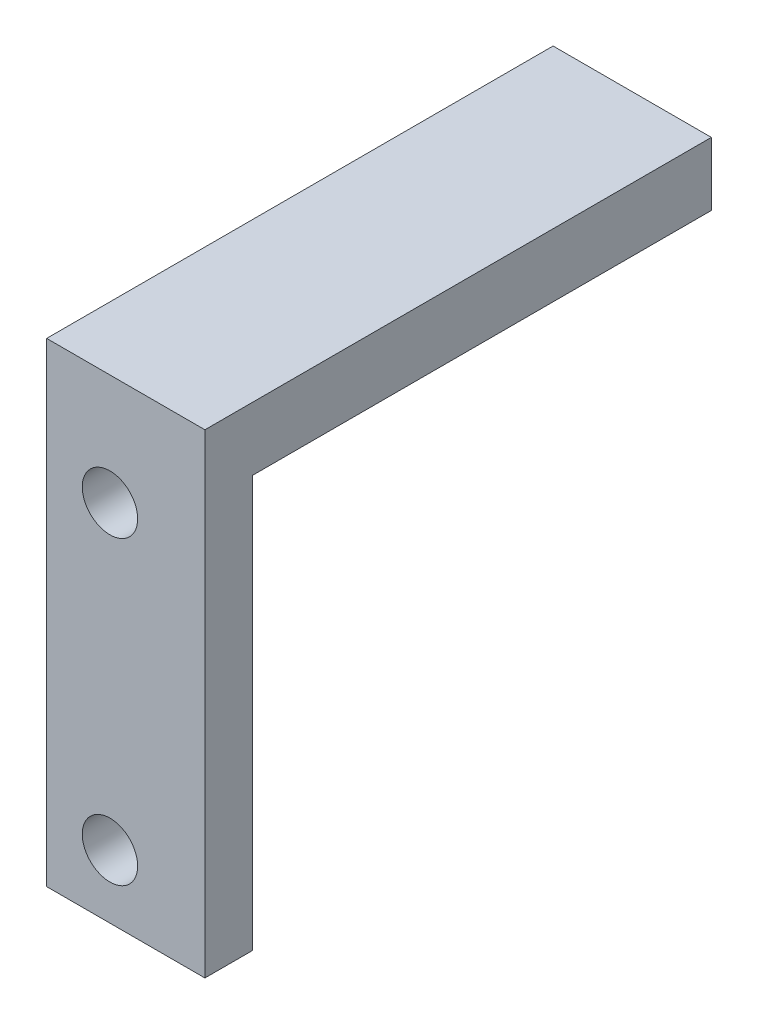
from build123d import *

# Parameters (mm, degrees)
SKETCH1_W           = 10
SKETCH1_H           = 30
SKETCH1_R           = 1.75
BOSS_EXTRUDE1_DEPTH = 32
SKETCH2_W           = 10
SKETCH2_H           = 26
CUT_EXTRUDE1_DEPTH  = 29


with BuildPart() as part:
    # Sketch1 → Boss-Extrude1 (new body)
    with BuildSketch(Plane.XY):
        with Locations((5, -15)):
            Rectangle(SKETCH1_W, SKETCH1_H)
        with Locations((4, -7)):
            Circle(SKETCH1_R, mode=Mode.SUBTRACT)
        with Locations((4, -26)):
            Circle(SKETCH1_R, mode=Mode.SUBTRACT)
    extrude(amount=BOSS_EXTRUDE1_DEPTH)

    # Sketch2 → Cut-Extrude1 (cut)
    with BuildSketch(Plane(origin=(0, 0, 0), x_dir=(-1, 0, 0), z_dir=(0, 0, -1))):
        with Locations((-5, -17)):
            Rectangle(SKETCH2_W, SKETCH2_H)
    extrude(amount=-CUT_EXTRUDE1_DEPTH, mode=Mode.SUBTRACT)


solid = part.part
